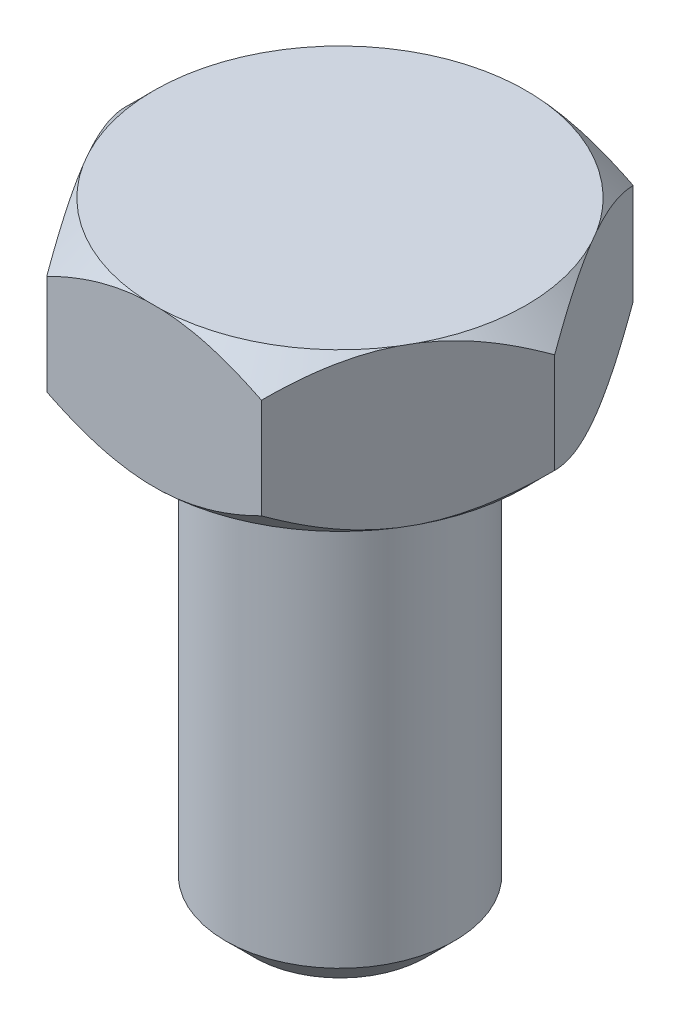
from build123d import *

# Parameters (mm, degrees)
EXTRUDE_1_DEPTH = 5.5
SKETCH_5_R      = 4
EXTRUDE_2_DEPTH = 16
CHAMFER_1_SIZE  = 1


with BuildPart() as part:
    # Эскиз1 → Вытянуть1 (new body)
    with BuildSketch(Plane(origin=(0, 0, 0), x_dir=(1, 0, 0), z_dir=(0, 1, 0))):
        Polygon((-3.75277675, 6.5), (3.75277675, 6.5), (7.505553499, 0), (3.75277675, -6.5), (-3.75277675, -6.5), (-7.505553499, 0), align=None)
    extrude(amount=-EXTRUDE_1_DEPTH)

    # Эскиз5 → Вытянуть2 (add)
    with BuildSketch(Plane.XZ.offset(5.5)):
        with Locations(Location((0, 0, 0), (0, 0, 90))):
            Circle(SKETCH_5_R)
    extrude(amount=EXTRUDE_2_DEPTH)

    # Фаска1
    chamfer_1_edges = [part.edges().sort_by_distance(p)[0] for p in [
        (0, -21.5, -4),
    ]]
    chamfer(chamfer_1_edges, length=CHAMFER_1_SIZE)

    # Эскиз4 → Вырез-Повернуть1 (revolve, cut)
    with BuildSketch(Plane.XY, mode=Mode.PRIVATE) as cut_revolve_1_sk:
        Polygon((-7.505553499, -1), (-6.505553499, 0), (-7.505553499, 0), align=None)
        Polygon((-7.505553499, -4.5), (-6.505553499, -5.5), (-7.505553499, -5.5), align=None)
    revolve(cut_revolve_1_sk.sketch.rotate(Axis((0, -5.5, 0), (0, -1, 0)), 90), axis=Axis((0, -5.5, 0), (0, -1, 0)), mode=Mode.SUBTRACT)


solid = part.part
